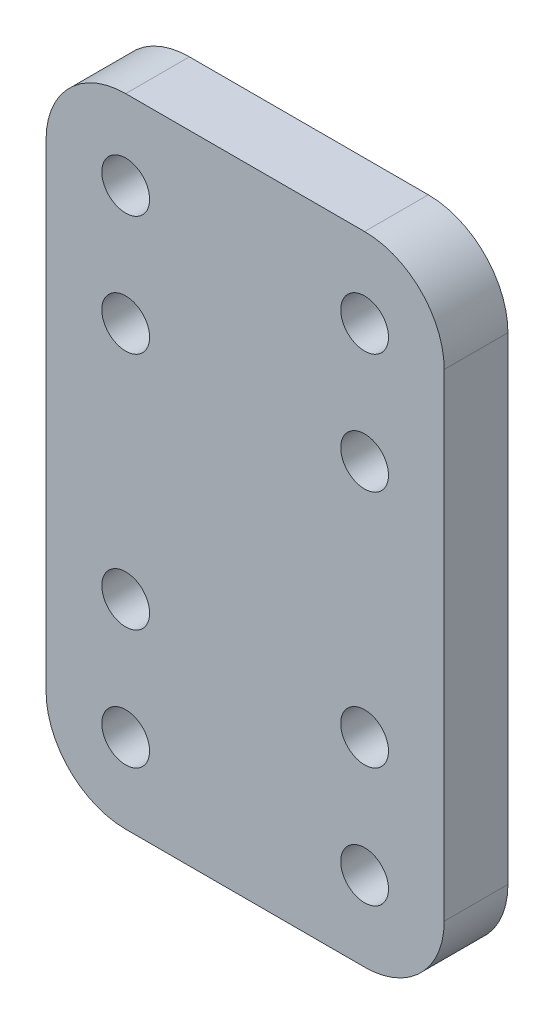
from build123d import *

# Parameters (mm, degrees)
SKETCH_1_W      = 25
SKETCH_1_H      = 40
SKETCH_1_R      = 1.5
EXTRUDE_1_DEPTH = 4
FILLET_1_R      = 5


with BuildPart() as part:
    # 草图1 → 凸台-拉伸1 (new body)
    with BuildSketch(Plane.XY):
        Rectangle(SKETCH_1_W, SKETCH_1_H)
        with Locations((-7.5, 15)):
            Circle(SKETCH_1_R, mode=Mode.SUBTRACT)
        with Locations((7.5, 15)):
            Circle(SKETCH_1_R, mode=Mode.SUBTRACT)
        with Locations((-7.5, -15)):
            Circle(SKETCH_1_R, mode=Mode.SUBTRACT)
        with Locations((7.5, -15)):
            Circle(SKETCH_1_R, mode=Mode.SUBTRACT)
        with Locations((-7.5, 7.5)):
            Circle(SKETCH_1_R, mode=Mode.SUBTRACT)
        with Locations((7.5, 7.5)):
            Circle(SKETCH_1_R, mode=Mode.SUBTRACT)
        with Locations((7.5, -7.5)):
            Circle(SKETCH_1_R, mode=Mode.SUBTRACT)
        with Locations((-7.5, -7.5)):
            Circle(SKETCH_1_R, mode=Mode.SUBTRACT)
    extrude(amount=EXTRUDE_1_DEPTH)

    # 圆角1
    fillet_1_edges = [part.edges().sort_by_distance(p)[0] for p in [
        (12.5, -20, 2),
        (-12.5, -20, 2),
        (-12.5, 20, 2),
        (12.5, 20, 2),
    ]]
    fillet(fillet_1_edges, radius=FILLET_1_R)


solid = part.part
